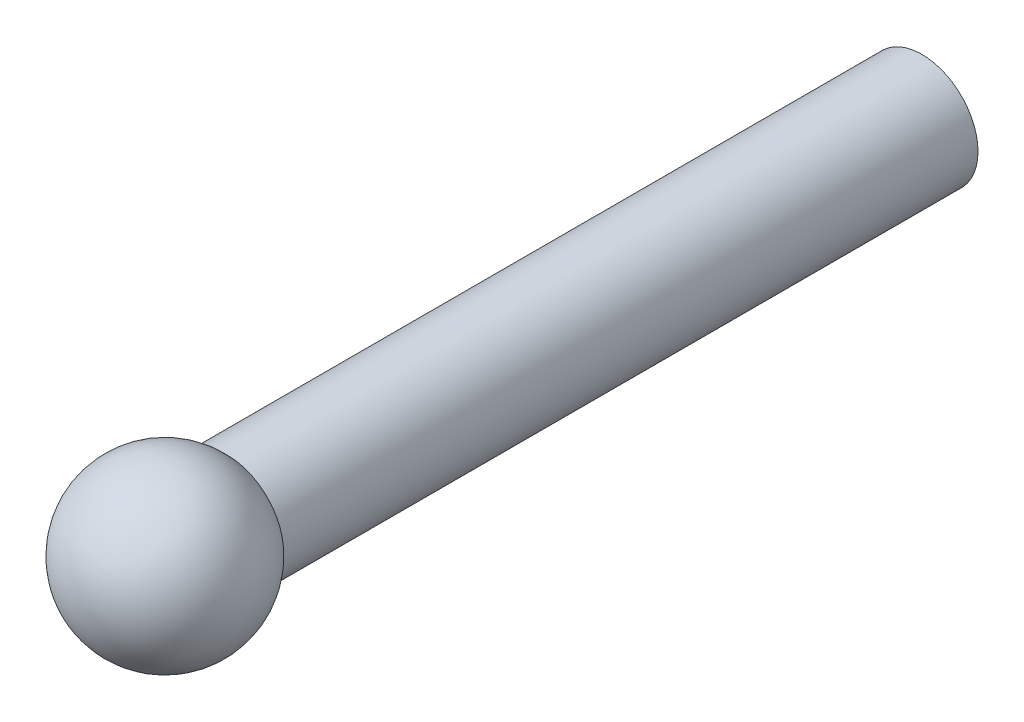
from build123d import *

# Parameters (mm, degrees)
SCHIZZO1_R                   = 2
ESTRUSIONE_ESTRUSIONE1_DEPTH = 25


with BuildPart() as part:
    # Schizzo1 → Estrusione-Estrusione1 (new body)
    with BuildSketch(Plane.XY):
        Circle(SCHIZZO1_R)
    extrude(amount=ESTRUSIONE_ESTRUSIONE1_DEPTH)

    # Schizzo3 → Rivoluzione2 (revolve)
    with BuildSketch(Plane(origin=(0, 0, 0), x_dir=(1, 0, 0), z_dir=(0, 1, 0))):
        with BuildLine():
            Line((3, -27), (0, -27))
            Line((0, -27), (-3, -27))
            ThreePointArc((-3, -27), (0, -30), (3, -27))
        make_face()
    revolve(axis=Axis((-3.329008964, 0, 27), (1, 0, 0)))


solid = part.part
